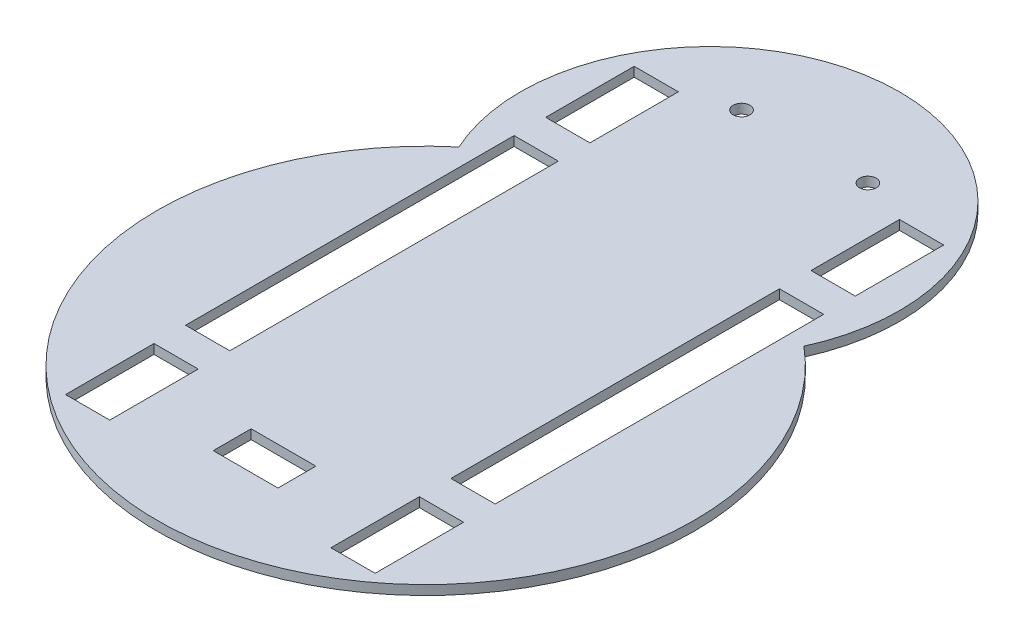
from build123d import *

# Parameters (mm, degrees)
CROQUIS1_W              = 14
CROQUIS1_H              = 10
SALIENTE_EXTRUIR1_DEPTH = 1.5
CROQUIS2_R              = 2.65
CROQUIS2_W              = 20.5
CROQUIS2_H              = 12
CORTAR_EXTRUIR1_DEPTH   = 10


with BuildPart() as part:
    # Croquis1 → Saliente-Extruir1 (new, symmetric)
    with BuildSketch(Plane(origin=(0, 0, 0), x_dir=(1, 0, 0), z_dir=(0, 1, 0))):
        with BuildLine():
            ThreePointArc((54.607006458, 65.138888889), (52.033105226, 60.124324936), (49, 55.373420614))
            Line((49, 55.373420614), (49, -27))
            Line((49, -27), (49, -37))
            Line((49, -37), (49, -65))
            Line((49, -65), (35, -65))
            Line((35, -65), (35, -37))
            Line((35, -37), (35, -27))
            Line((35, -27), (35, 41.266028276))
            ThreePointArc((35, 41.266028276), (0, 30), (-35, 41.266028276))
            Line((-35, 41.266028276), (-35, -27))
            Line((-35, -27), (-35, -37))
            Line((-35, -37), (-35, -65))
            Line((-35, -65), (-49, -65))
            Line((-49, -65), (-49, -37))
            Line((-49, -37), (-49, -27))
            Line((-49, -27), (-49, 55.373420614))
            ThreePointArc((-49, 55.373420614), (-52.033105226, 60.124324936), (-54.607006458, 65.138888889))
            ThreePointArc((-54.607006458, 65.138888889), (-35.940259119, -77.027902571), (85, 0))
            ThreePointArc((85, 0), (77.027902571, 35.940259119), (54.607006458, 65.138888889))
        make_face()
        with BuildLine():
            Line((35, 77), (35, 77.459666924))
            ThreePointArc((35, 77.459666924), (0, 85), (-35, 77.459666924))
            Line((-35, 77.459666924), (-35, 77))
            Line((-35, 77), (-35, 41.266028276))
            ThreePointArc((-35, 41.266028276), (0, 30), (35, 41.266028276))
            Line((35, 41.266028276), (35, 77))
        make_face()
        with BuildLine():
            Line((-49, 55.373420614), (-49, 69.455021417))
            ThreePointArc((-49, 69.455021417), (-51.848434854, 67.35532498), (-54.607006458, 65.138888889))
            ThreePointArc((-54.607006458, 65.138888889), (-52.033105226, 60.124324936), (-49, 55.373420614))
        make_face()
        with BuildLine():
            Line((35, 115), (49, 115))
            Line((49, 115), (49, 87))
            Line((49, 87), (49, 77))
            Line((49, 77), (49, 69.455021417))
            ThreePointArc((49, 69.455021417), (51.848434854, 67.35532498), (54.607006458, 65.138888889))
            ThreePointArc((54.607006458, 65.138888889), (58.636253238, 77.280337809), (60, 90))
            ThreePointArc((60, 90), (-12.719662191, 148.636253238), (-54.607006458, 65.138888889))
            ThreePointArc((-54.607006458, 65.138888889), (-51.848434854, 67.35532498), (-49, 69.455021417))
            Line((-49, 69.455021417), (-49, 77))
            Line((-49, 77), (-49, 87))
            Line((-49, 87), (-49, 115))
            Line((-49, 115), (-35, 115))
            Line((-35, 115), (-35, 87))
            Line((-35, 87), (-35, 77.459666924))
            ThreePointArc((-35, 77.459666924), (0, 85), (35, 77.459666924))
            Line((35, 77.459666924), (35, 87))
            Line((35, 87), (35, 115))
        make_face()
        with BuildLine():
            ThreePointArc((54.607006458, 65.138888889), (51.848434854, 67.35532498), (49, 69.455021417))
            Line((49, 69.455021417), (49, 55.373420614))
            ThreePointArc((49, 55.373420614), (52.033105226, 60.124324936), (54.607006458, 65.138888889))
        make_face()
        with Locations((-42, -32)):
            Rectangle(CROQUIS1_W, CROQUIS1_H)
        with Locations((42, -32)):
            Rectangle(CROQUIS1_W, CROQUIS1_H)
        with Locations((42, 82)):
            Rectangle(CROQUIS1_W, CROQUIS1_H)
        with Locations((-42, 82)):
            Rectangle(CROQUIS1_W, CROQUIS1_H)
    extrude(amount=SALIENTE_EXTRUIR1_DEPTH, both=True)

    # Croquis2 → Cortar-Extruir1 (cut)
    with BuildSketch(Plane.XZ.offset(1.5)):
        with Locations(Location((-20, -120, 0), (0, 0, 270))):
            Circle(CROQUIS2_R)
        with Locations(Location((20, -120, 0), (0, 0, 270))):
            Circle(CROQUIS2_R)
        with Locations((0, 51)):
            Rectangle(CROQUIS2_W, CROQUIS2_H)
    extrude(amount=-CORTAR_EXTRUIR1_DEPTH, mode=Mode.SUBTRACT)


solid = part.part
